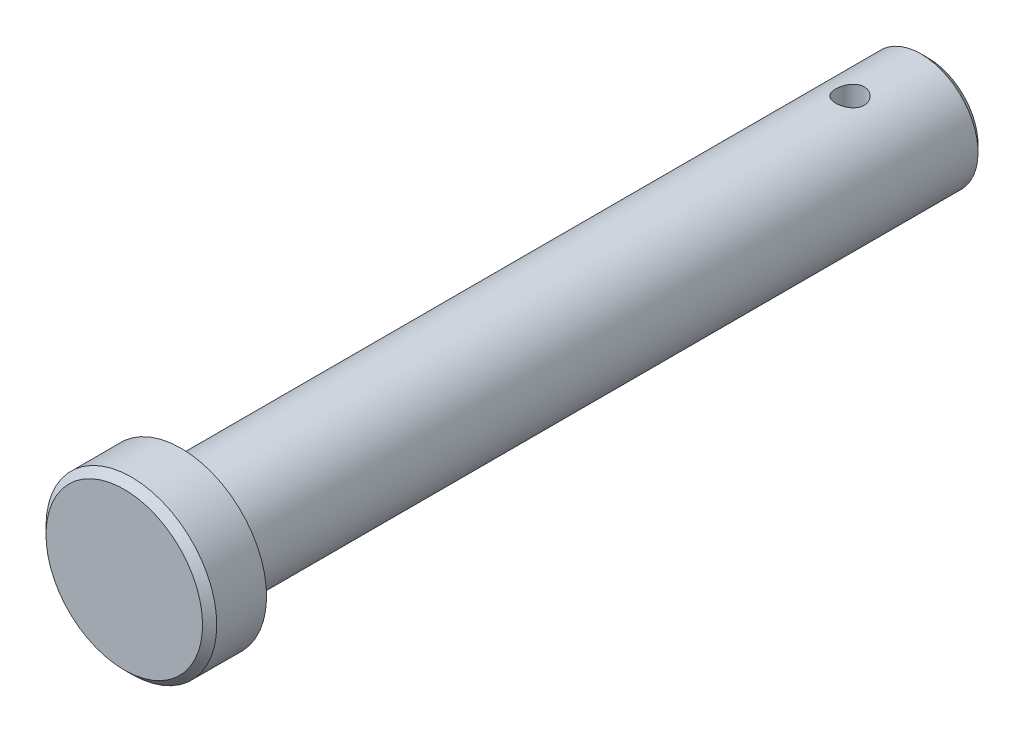
from build123d import *

# Parameters (mm, degrees)
CUT_EXTRUDE1_DEPTH      = 115.267230648
CUT_EXTRUDE1_DEPTH_BACK = 115.267230648
SKETCH2_R               = 2
CHAMFER1_SIZE           = 1


with BuildPart() as part:
    # Sketch1 → Revolve1 (revolve)
    with BuildSketch(Plane(origin=(0, 0, 0), x_dir=(0, 0, -1), z_dir=(1, 0, 0))):
        Polygon((0, 0), (0, 12), (8, 12), (8, 8), (113, 8), (113, 0), align=None)
    revolve(axis=Axis((0, 0, -113), (0, 0, 1)))

    # Sketch2 → Cut-Extrude1 (cut, two sides: drawn at the far end of the back side and taken through both)
    with BuildSketch(Plane(origin=(0, 0, 0), x_dir=(1, 0, 0), z_dir=(0, 1, 0)).offset(-CUT_EXTRUDE1_DEPTH_BACK)):
        with Locations(Location((0, 102, 0), (0, 0, 270))):
            Circle(SKETCH2_R)
    extrude(amount=CUT_EXTRUDE1_DEPTH + CUT_EXTRUDE1_DEPTH_BACK, mode=Mode.SUBTRACT)

    # Chamfer1
    chamfer1_edges = [part.edges().sort_by_distance(p)[0] for p in [
        (0, -8, -113),
        (0, -12, 0),
    ]]
    chamfer(chamfer1_edges, length=CHAMFER1_SIZE)


solid = part.part
